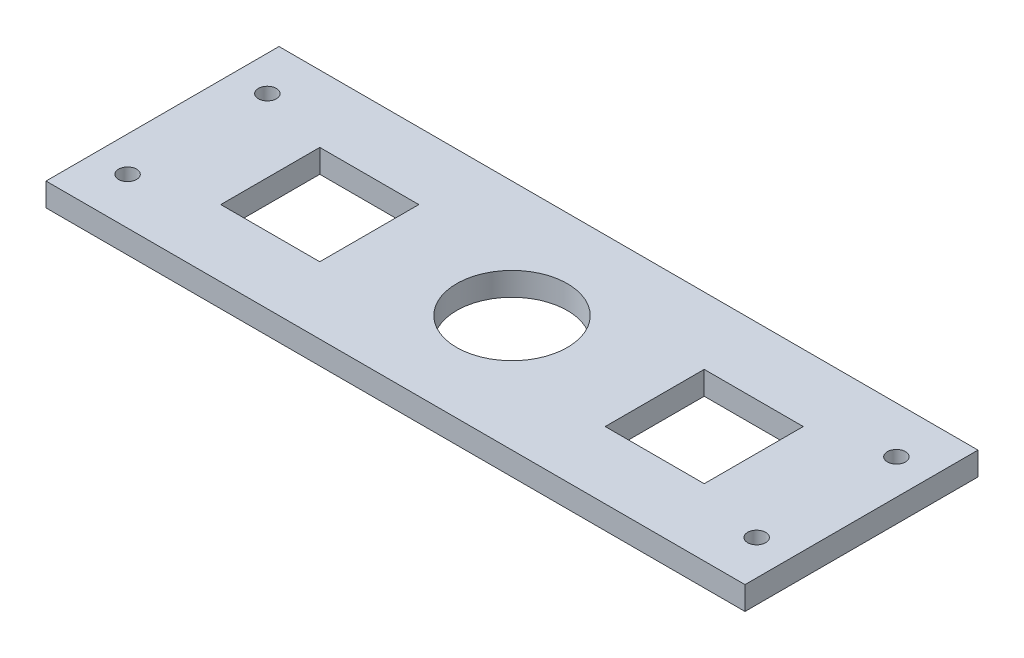
from build123d import *

# Parameters (mm, degrees)
SKETCH1_W                    = 190.5
SKETCH1_H                    = 63.5
BOSS_EXTRUDE1_DEPTH          = 6.35
SKETCH3_W                    = 26.9875
SKETCH3_H                    = 26.9875
CUT_EXTRUDE2_DEPTH           = 201.905008648
SKETCH4_W                    = 26.9875
SKETCH4_H                    = 26.9875
CUT_EXTRUDE3_DEPTH           = 201.905008648
SKETCH5_R                    = 15.08125
CUT_EXTRUDE4_DEPTH           = 201.905008648
F_10_0_1935_DIAMETER_HOLE1_D = 4.9149


with BuildPart() as part:
    # Sketch1 → Boss-Extrude1 (new body)
    with BuildSketch(Plane(origin=(0, 0, 0), x_dir=(1, 0, 0), z_dir=(0, 1, 0))):
        with Locations((95.25, 31.75)):
            Rectangle(SKETCH1_W, SKETCH1_H)
    extrude(amount=BOSS_EXTRUDE1_DEPTH)

    # Sketch3 → Cut-Extrude2 (cut, through all)
    with BuildSketch(Plane(origin=(0, 6.35, 0), x_dir=(1, 0, 0), z_dir=(0, 1, 0))):
        with Locations((42.8625, 31.75)):
            Rectangle(SKETCH3_W, SKETCH3_H)
    extrude(amount=-CUT_EXTRUDE2_DEPTH, mode=Mode.SUBTRACT)

    # Sketch4 → Cut-Extrude3 (cut, through all)
    with BuildSketch(Plane(origin=(0, 6.35, 0), x_dir=(1, 0, 0), z_dir=(0, 1, 0))):
        with Locations((147.6375, 31.75)):
            Rectangle(SKETCH4_W, SKETCH4_H)
    extrude(amount=-CUT_EXTRUDE3_DEPTH, mode=Mode.SUBTRACT)

    # Sketch5 → Cut-Extrude4 (cut, through all)
    with BuildSketch(Plane(origin=(0, 6.35, 0), x_dir=(1, 0, 0), z_dir=(0, 1, 0))):
        with Locations(Location((95.25, 31.75, 0), (0, 0, 270))):
            Circle(SKETCH5_R)
    extrude(amount=-CUT_EXTRUDE4_DEPTH, mode=Mode.SUBTRACT)

    # #10 (0.1935) Diameter Hole1 (through all)
    with Locations(Plane(origin=(0, 6.35, 0), x_dir=(1, 0, 0), z_dir=(0, 1, 0))):
        with Locations((9.525, 50.8), (9.525, 12.7), (180.975, 12.7), (180.975, 50.8)):
            Hole(F_10_0_1935_DIAMETER_HOLE1_D / 2)


solid = part.part
